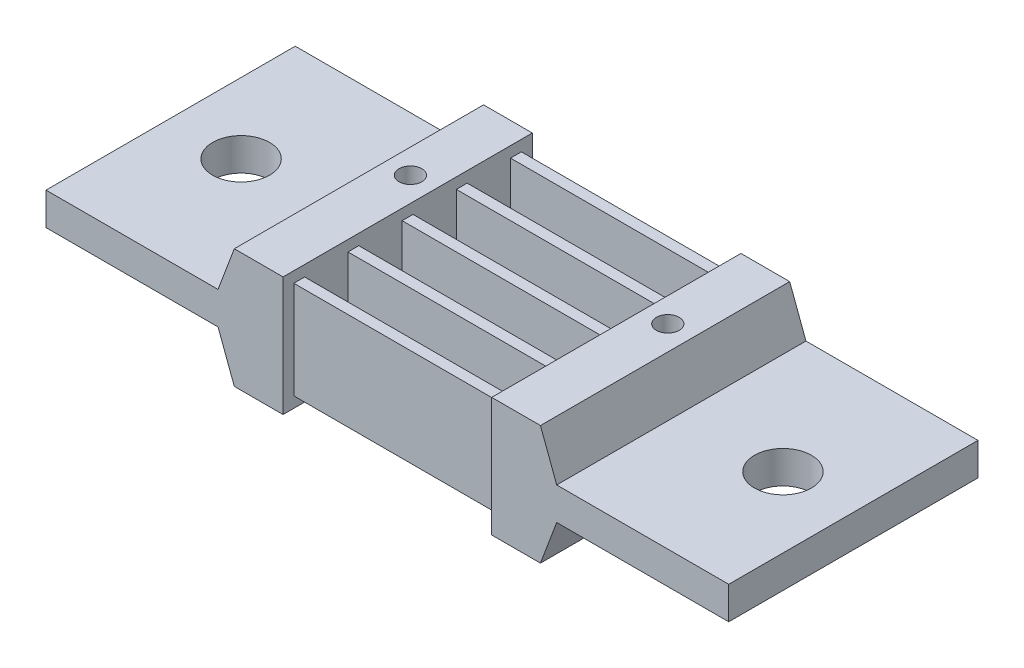
from build123d import *

# Parameters (mm, degrees)
BOSS_EXTRUDE1_DEPTH        = 3
BOSS_EXTRUDE1_DEPTH_BACK   = 3
SKETCH1_W                  = 31.75
SKETCH1_H                  = 46
SKETCH1_R                  = 5.25
BOSS_EXTRUDE1_2_DEPTH      = 3
BOSS_EXTRUDE1_2_DEPTH_BACK = 3
BOSS_EXTRUDE2_DEPTH        = 11
BOSS_EXTRUDE2_DEPTH_BACK   = 11
SKETCH2_W                  = 9
SKETCH2_H                  = 46
BOSS_EXTRUDE2_2_DEPTH      = 11
BOSS_EXTRUDE2_2_DEPTH_BACK = 11
BOSS_EXTRUDE3_DEPTH        = 46
M5X0_8_TAPPED_HOLE1_D      = 4.2
M5X0_8_TAPPED_HOLE1_DEPTH  = 10
BOSS_EXTRUDE4_DEPTH        = 9
BOSS_EXTRUDE4_DEPTH_BACK   = 9
SKETCH6_W                  = 38.5
SKETCH6_H                  = 2


with BuildPart() as part:
    # Sketch1 → Boss-Extrude1 (new, two sides: drawn at the far end of the back side and taken through both)
    with BuildSketch(Plane(origin=(0, 0, 0), x_dir=(1, 0, 0), z_dir=(0, 1, 0)).offset(-BOSS_EXTRUDE1_DEPTH_BACK)):
        with Locations((-47.125, 23)):
            Rectangle(SKETCH1_W, SKETCH1_H)
        with Locations(Location((-50, 23, 0), (0, 0, 270))):
            Circle(SKETCH1_R, mode=Mode.SUBTRACT)
    extrude(amount=BOSS_EXTRUDE1_DEPTH + BOSS_EXTRUDE1_DEPTH_BACK)



with BuildPart() as body_2:
    # Sketch1 → Boss-Extrude1 2 (new, two sides: drawn at the far end of the back side and taken through both)
    with BuildSketch(Plane(origin=(0, 0, 0), x_dir=(1, 0, 0), z_dir=(0, 1, 0)).offset(-BOSS_EXTRUDE1_2_DEPTH_BACK)):
        with Locations((47.125, 23)):
            Rectangle(SKETCH1_W, SKETCH1_H)
        with Locations(Location((50, 23, 0), (0, 0, 270))):
            Circle(SKETCH1_R, mode=Mode.SUBTRACT)
    extrude(amount=BOSS_EXTRUDE1_2_DEPTH + BOSS_EXTRUDE1_2_DEPTH_BACK)


with BuildPart() as body_3:
    # Sketch2 → Boss-Extrude2 (new, two sides: drawn at the far end of the back side and taken through both)
    with BuildSketch(Plane(origin=(0, 0, 0), x_dir=(1, 0, 0), z_dir=(0, 1, 0)).offset(-BOSS_EXTRUDE2_DEPTH_BACK)):
        with Locations((23.75, 23)):
            Rectangle(SKETCH2_W, SKETCH2_H)
    extrude(amount=BOSS_EXTRUDE2_DEPTH + BOSS_EXTRUDE2_DEPTH_BACK)


with BuildPart() as body_4:
    # Sketch2 → Boss-Extrude2 2 (new, two sides: drawn at the far end of the back side and taken through both)
    with BuildSketch(Plane(origin=(0, 0, 0), x_dir=(1, 0, 0), z_dir=(0, 1, 0)).offset(-BOSS_EXTRUDE2_2_DEPTH_BACK)):
        with Locations((-23.75, 23)):
            Rectangle(SKETCH2_W, SKETCH2_H)
    extrude(amount=BOSS_EXTRUDE2_2_DEPTH + BOSS_EXTRUDE2_2_DEPTH_BACK)


with BuildPart() as part_1:
    add(part.part)

    add(body_2.part)  # Boss-Extrude3 merges body 2

    add(body_3.part)  # Boss-Extrude3 merges body 3

    add(body_4.part)  # Boss-Extrude3 merges body 4
    # Sketch3 → Boss-Extrude3 (add, through all)
    with BuildSketch(Plane.XY):
        Polygon((28.25, 11), (31.25, 3), (31.25, -3), (28.25, -11), align=None)
        Polygon((-31.25, 3), (-31.25, -3), (-28.25, -11), (-28.25, 11), align=None)
    extrude(amount=-BOSS_EXTRUDE3_DEPTH)

    # M5x0.8 Tapped Hole1
    with Locations(Plane(origin=(0, 11, 0), x_dir=(1, 0, 0), z_dir=(0, 1, 0))):
        with Locations((-23.75, 28), (23.75, 28)):
            Hole(M5X0_8_TAPPED_HOLE1_D / 2, depth=M5X0_8_TAPPED_HOLE1_DEPTH)

    # Sketch6 → Boss-Extrude4 (add, two sides: drawn at the far end of the back side and taken through both)
    with BuildSketch(Plane(origin=(0, 0, 0), x_dir=(1, 0, 0), z_dir=(0, 1, 0)).offset(-BOSS_EXTRUDE4_DEPTH_BACK)):
        with Locations((0, 2.975890667)):
            Rectangle(SKETCH6_W, SKETCH6_H)
        with Locations((0, 12.975890667)):
            Rectangle(SKETCH6_W, SKETCH6_H)
        with Locations((0, 22.975890667)):
            Rectangle(SKETCH6_W, SKETCH6_H)
        with Locations((0, 32.975890667)):
            Rectangle(SKETCH6_W, SKETCH6_H)
        with Locations((0, 42.975890667)):
            Rectangle(SKETCH6_W, SKETCH6_H)
    extrude(amount=BOSS_EXTRUDE4_DEPTH + BOSS_EXTRUDE4_DEPTH_BACK)


solid = part_1.part
